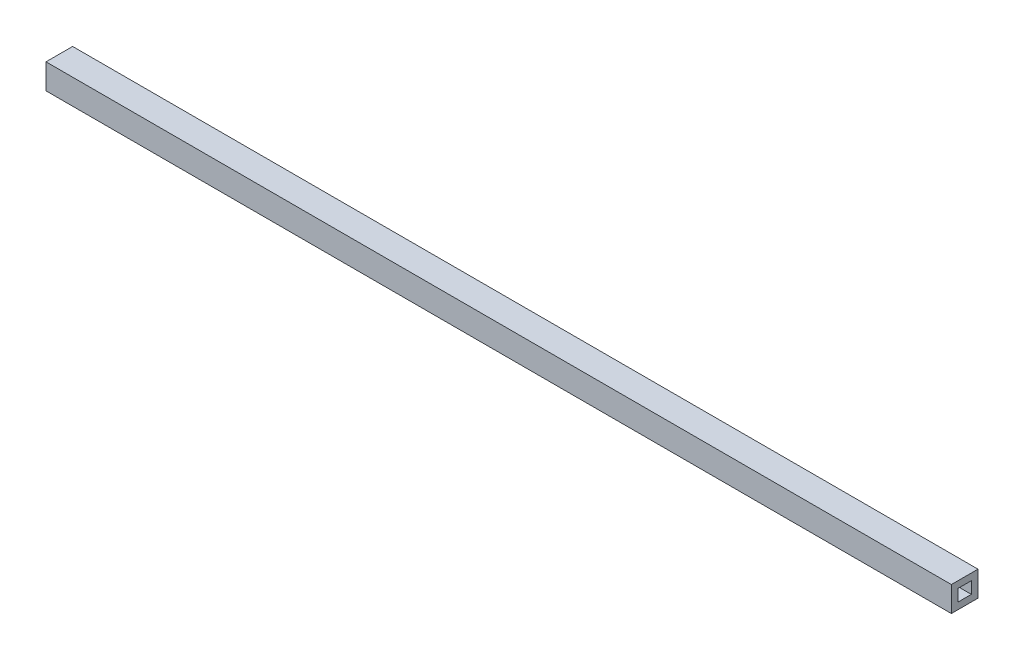
from build123d import *

# Parameters (mm, degrees)
SKETCH1_W           = 863.6
SKETCH1_H           = 23.988888888
BOSS_EXTRUDE1_DEPTH = 12.7
SKETCH2_W           = 12.7
SKETCH2_H           = 11.288888888
CUT_EXTRUDE1_DEPTH  = 864.776659037


with BuildPart() as part:
    # Sketch1 → Boss-Extrude1 (new, symmetric)
    with BuildSketch(Plane.XY):
        Rectangle(SKETCH1_W, SKETCH1_H)
    extrude(amount=BOSS_EXTRUDE1_DEPTH, both=True)

    # Sketch2 → Cut-Extrude1 (cut, through all)
    with BuildSketch(Plane(origin=(431.8, 0, 0), x_dir=(0, 0, -1), z_dir=(1, 0, 0))):
        Rectangle(SKETCH2_W, SKETCH2_H)
    extrude(amount=-CUT_EXTRUDE1_DEPTH, mode=Mode.SUBTRACT)


solid = part.part
